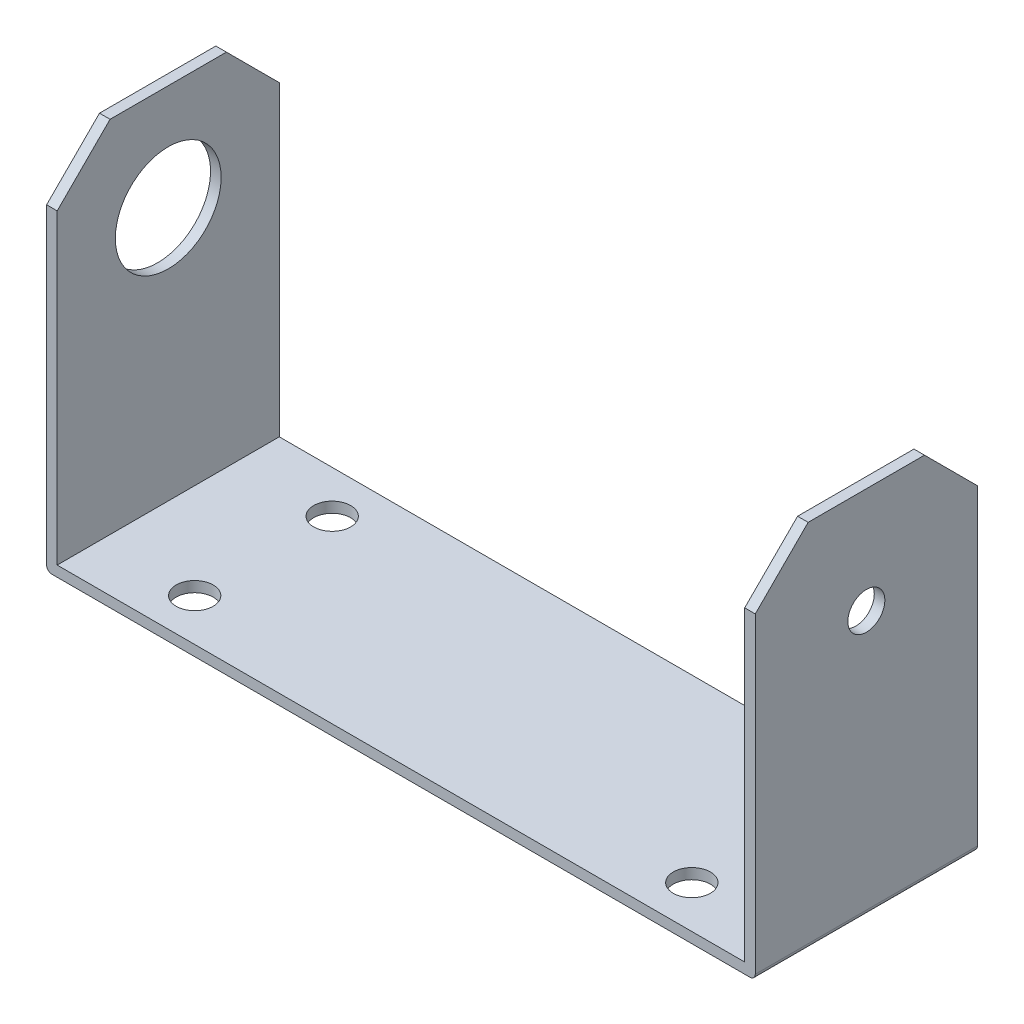
from build123d import *

# Parameters (mm, degrees)
SKETCH_1_W                  = 67
SKETCH_1_H                  = 21
EXTRUDE_1_DEPTH             = 35
SHELL_1_T                   = -1
FILLET_2_R                  = 0.5
CHAMFER_1_SIZE              = 5
HOLE_WIZARD_3_5_3_5_1_D     = 3.5
HOLE_WIZARD_10_0_10_1_D     = 10
HOLE_WIZARD_10_0_10_1_DEPTH = 1
HOLE_WIZARD_3_5_3_5_2_D     = 3.5


with BuildPart() as part:
    # 草图1 → 凸台-拉伸1 (new body)
    with BuildSketch(Plane(origin=(0, 0, 0), x_dir=(1, 0, 0), z_dir=(0, 1, 0))):
        with Locations((-33.5, 10.5)):
            Rectangle(SKETCH_1_W, SKETCH_1_H)
    extrude(amount=EXTRUDE_1_DEPTH)

    # 抽壳1
    shell_1_openings = [part.faces().sort_by_distance(p)[0] for p in [
        (-33.5, 35, -10.5),
        (-33.5, 17.5, 0),
        (-33.5, 17.5, -21),
    ]]
    offset(amount=SHELL_1_T, openings=shell_1_openings, kind=Kind.INTERSECTION)

    # 圆角2
    fillet_2_edges = [part.edges().sort_by_distance(p)[0] for p in [
        (-67, 0, -10.5),
        (0, 0, -10.5),
    ]]
    fillet(fillet_2_edges, radius=FILLET_2_R)

    # 倒角1
    chamfer_1_edges = [part.edges().sort_by_distance(p)[0] for p in [
        (-66.5, 35, 0),
        (-66.5, 35, -21),
        (-0.5, 35, 0),
        (-0.5, 35, -21),
    ]]
    chamfer(chamfer_1_edges, length=CHAMFER_1_SIZE)

    # Ø3.5 (3.5) 直径槽口1 (through all)
    with Locations(Plane(origin=(0, 1, 0), x_dir=(1, 0, 0), z_dir=(0, 1, 0))):
        with Locations((-57, 17), (-10, 17), (-10, 4), (-57, 4)):
            Hole(HOLE_WIZARD_3_5_3_5_1_D / 2)

    # Ø10.0 (10) 直径槽口1
    with Locations(Plane.ZY.offset(67)):
        with Locations((-10.5, 25)):
            Hole(HOLE_WIZARD_10_0_10_1_D / 2, depth=HOLE_WIZARD_10_0_10_1_DEPTH)

    # Ø3.5 (3.5) 直径槽口2 (through all)
    with Locations(Plane(origin=(0, 0, 0), x_dir=(0, 0, -1), z_dir=(1, 0, 0))):
        with Locations((10.5, 25)):
            Hole(HOLE_WIZARD_3_5_3_5_2_D / 2)


solid = part.part
